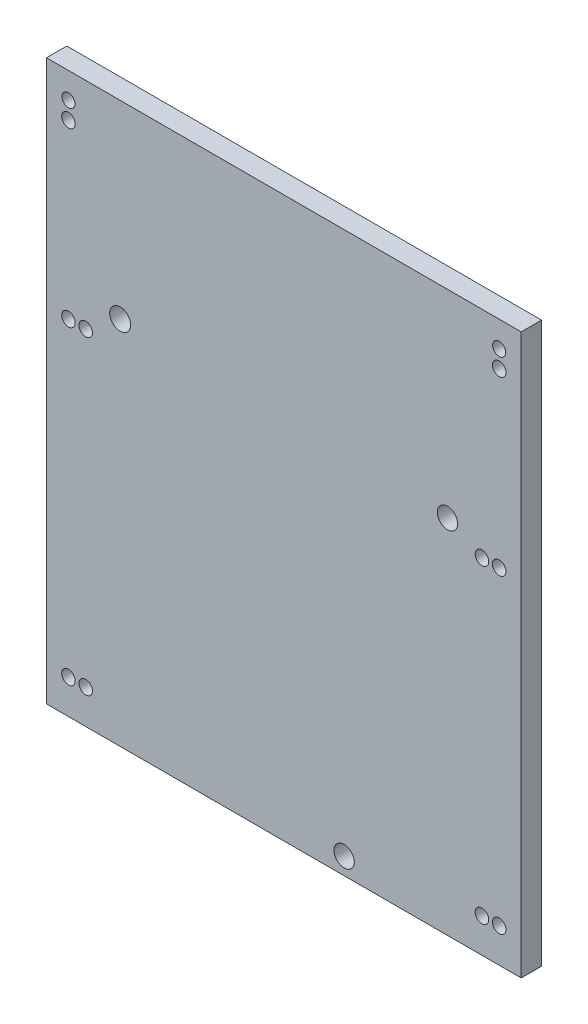
from build123d import *

# Parameters (mm, degrees)
ESQUISSE1_W        = 70
ESQUISSE1_H        = 82.5
ESQUISSE1_R        = 1.5
ESQUISSE1_R_2      = 1.548892625
ESQUISSE1_R_3      = 0.965612554
ESQUISSE1_R_4      = 1
BOSS_EXTRU_1_DEPTH = 3


with BuildPart() as part:
    # Esquisse1 → Boss.-Extru.1 (new body)
    with BuildSketch(Plane.XY):
        with Locations((35, 41.25)):
            Rectangle(ESQUISSE1_W, ESQUISSE1_H)
        with Locations((43.89, 2.5)):
            Circle(ESQUISSE1_R, mode=Mode.SUBTRACT)
        with Locations((10.87, 54.57)):
            Circle(ESQUISSE1_R_2, mode=Mode.SUBTRACT)
        with Locations((59.13, 53.3)):
            Circle(ESQUISSE1_R, mode=Mode.SUBTRACT)
        with Locations((3.25, 78.7)):
            Circle(ESQUISSE1_R_3, mode=Mode.SUBTRACT)
        with Locations((3.25, 76.16)):
            Circle(ESQUISSE1_R_4, mode=Mode.SUBTRACT)
        with Locations((66.75, 78.7)):
            Circle(ESQUISSE1_R_3, mode=Mode.SUBTRACT)
        with Locations((66.75, 76.16)):
            Circle(ESQUISSE1_R_4, mode=Mode.SUBTRACT)
        with Locations((3.25, 5.04)):
            Circle(ESQUISSE1_R_4, mode=Mode.SUBTRACT)
        with Locations((5.79, 5.04)):
            Circle(ESQUISSE1_R_4, mode=Mode.SUBTRACT)
        with Locations((66.75, 5.04)):
            Circle(ESQUISSE1_R_4, mode=Mode.SUBTRACT)
        with Locations((64.21, 5.04)):
            Circle(ESQUISSE1_R_4, mode=Mode.SUBTRACT)
        with Locations((3.25, 50.76)):
            Circle(ESQUISSE1_R_4, mode=Mode.SUBTRACT)
        with Locations((5.79, 50.76)):
            Circle(ESQUISSE1_R_4, mode=Mode.SUBTRACT)
        with Locations((66.75, 50.76)):
            Circle(ESQUISSE1_R_4, mode=Mode.SUBTRACT)
        with Locations((64.21, 50.76)):
            Circle(ESQUISSE1_R_4, mode=Mode.SUBTRACT)
    extrude(amount=BOSS_EXTRU_1_DEPTH)


solid = part.part
